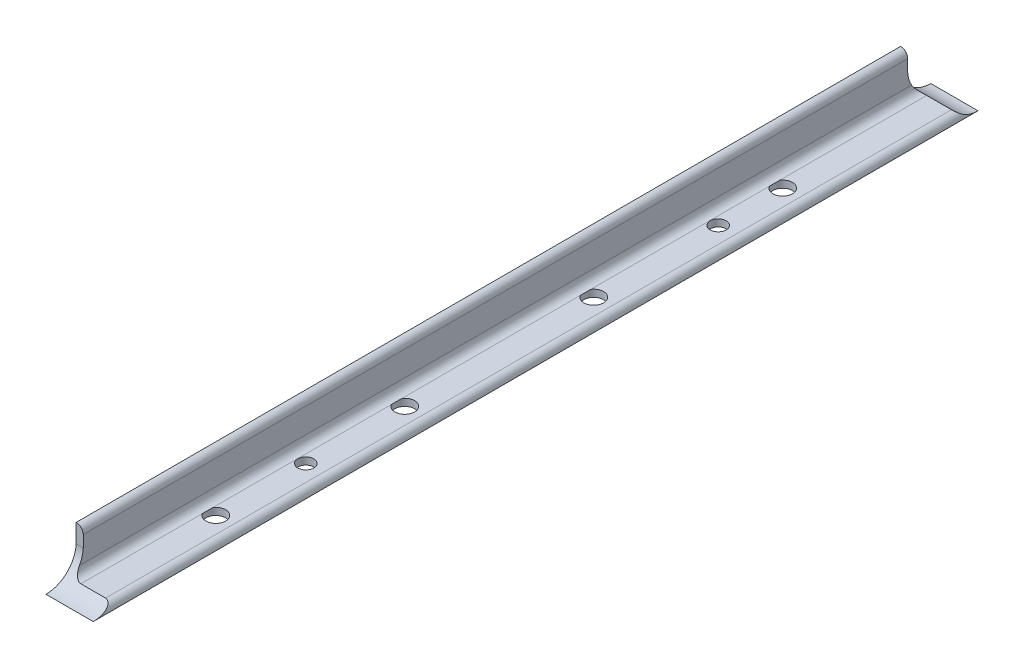
from build123d import *

# Parameters (mm, degrees)
MIEMBRO_ESTRUCTURAL1_DEPTH    = 374.6
CORTAR_EXTRUIR2_DEPTH         = 196.288143284
TALADRO_DE_MARGEN_PARA_1_41_D = 6.7564
SKETCH2_R                     = 4.1671875
CUT_EXTRUDE2_DEPTH            = 3


with BuildPart() as part:
    # Sketch1 → Miembro estructural1 (new body)
    with BuildSketch(Plane.XY.offset(-193.229032258)):
        with BuildLine():
            Line((0, 0), (0, 20))
            ThreePointArc((0, 20), (2.121320344, 19.121320344), (3, 17))
            Line((3, 17), (3, 6.5))
            ThreePointArc((3, 6.5), (4.025126266, 4.025126266), (6.5, 3))
            Line((6.5, 3), (17, 3))
            ThreePointArc((17, 3), (19.121320344, 2.121320344), (20, 0))
            Line((20, 0), (0, 0))
        make_face()
    extrude(amount=MIEMBRO_ESTRUCTURAL1_DEPTH)

    # Croquis2 → Cortar-Extruir2 (cut, through all)
    with BuildSketch(Plane.YZ):
        with BuildLine():
            Line((12.119137035, 168.589088943), (20, 168.589088943))
            Line((20, 168.589088943), (20, 181.370967742))
            Line((20, 181.370967742), (0, 181.370967742))
            ThreePointArc((0, 181.370967742), (3.51143052, 172.56401157), (12.119137035, 168.589088943))
        make_face()
        with BuildLine():
            Line((22.851984592, -180.447153459), (12.119137035, -180.447153459))
            ThreePointArc((12.119137035, -180.447153459), (3.51143052, -184.422076086), (0, -193.229032258))
            Line((0, -193.229032258), (0, -196.975216041))
            Line((0, -196.975216041), (22.851984592, -196.975216041))
            Line((22.851984592, -196.975216041), (22.851984592, -180.447153459))
        make_face()
    extrude(amount=CORTAR_EXTRUIR2_DEPTH, mode=Mode.SUBTRACT)

    # Taladro de margen para 1/41 (through all)
    with Locations(Plane(origin=(0, 0, 0), x_dir=(-1, 0, 0), z_dir=(0, -1, 0))):
        with Locations((-10, -81.370967742), (-10, 93.229032258)):
            Hole(TALADRO_DE_MARGEN_PARA_1_41_D / 2)

    # Sketch2 → Cut-Extrude2 (cut)
    with BuildSketch(Plane.XZ):
        with Locations(Location((10, -40.529032258, 0), (0, 0, 270))):
            Circle(SKETCH2_R)
        with Locations(Location((10, 39.470967742, 0), (0, 0, 270))):
            Circle(SKETCH2_R)
        with Locations(Location((10, 119.470967742, 0), (0, 0, 270))):
            Circle(SKETCH2_R)
        with Locations(Location((10, -120.529032258, 0), (0, 0, 270))):
            Circle(SKETCH2_R)
    extrude(amount=-CUT_EXTRUDE2_DEPTH, mode=Mode.SUBTRACT)


solid = part.part
